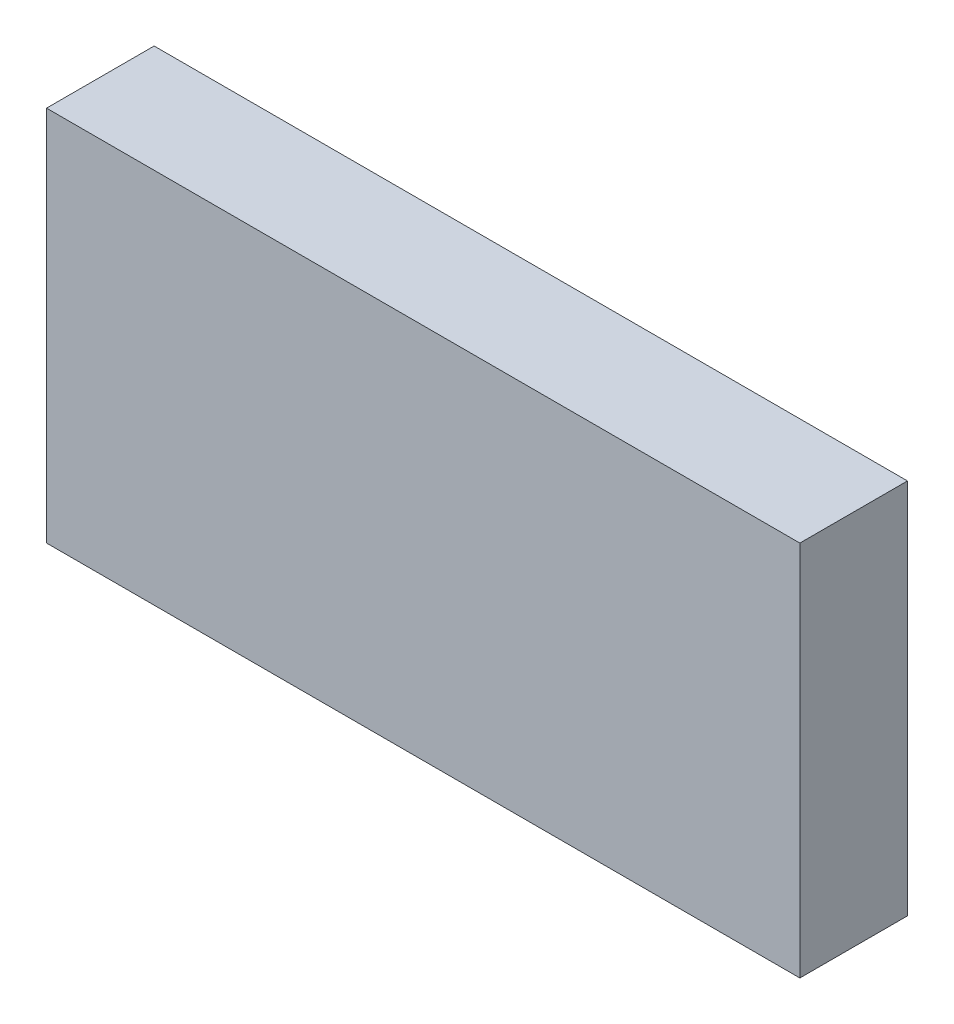
from build123d import *

# Parameters (mm, degrees)
SKETCH_1_W      = 140
SKETCH_1_H      = 70
EXTRUDE_1_DEPTH = 20


with BuildPart() as part:
    # 草图1 → 凸台-拉伸1 (new body)
    with BuildSketch(Plane.XY):
        Rectangle(SKETCH_1_W, SKETCH_1_H)
    extrude(amount=EXTRUDE_1_DEPTH)


solid = part.part
